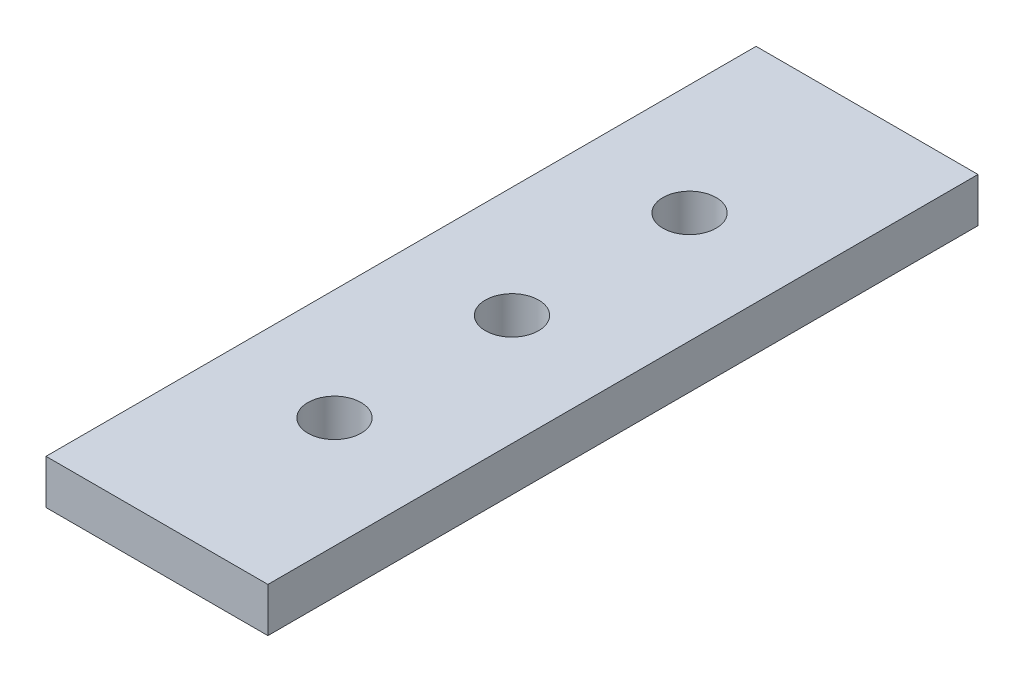
from build123d import *

# Parameters (mm, degrees)
SKETCH_1_W      = 50
SKETCH_1_H      = 160
SKETCH_1_R      = 6
EXTRUDE_1_DEPTH = 10


with BuildPart() as part:
    # 草图1 → 凸台-拉伸1 (new body)
    with BuildSketch(Plane(origin=(0, 0, 0), x_dir=(1, 0, 0), z_dir=(0, 1, 0))):
        with Locations((-25, 80)):
            Rectangle(SKETCH_1_W, SKETCH_1_H)
        with Locations(Location((-25, 120, 0), (0, 0, 270))):
            Circle(SKETCH_1_R, mode=Mode.SUBTRACT)
        with Locations(Location((-25, 80, 0), (0, 0, 270))):
            Circle(SKETCH_1_R, mode=Mode.SUBTRACT)
        with Locations(Location((-25, 40, 0), (0, 0, 270))):
            Circle(SKETCH_1_R, mode=Mode.SUBTRACT)
    extrude(amount=EXTRUDE_1_DEPTH)


solid = part.part
